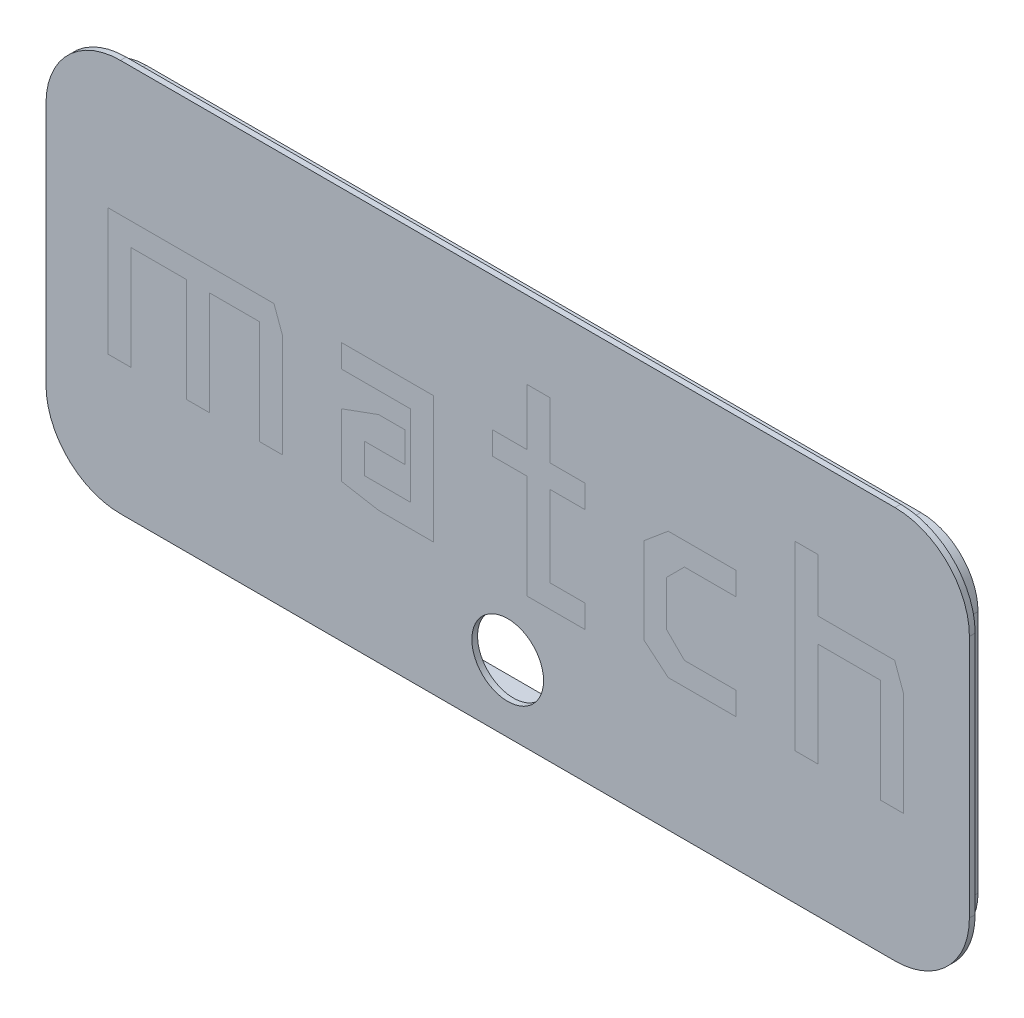
from build123d import *

# Parameters (mm, degrees)
SKIZZE1_W                         = 7.426009652
SKIZZE1_H                         = 9.839014478
AUFSATZ_LINEAR_AUSTRAGEN1_DEPTH   = 1.4
AUFSATZ_LINEAR_AUSTRAGEN1_2_DEPTH = 1.4
AUFSATZ_LINEAR_AUSTRAGEN1_3_DEPTH = 1.4
AUFSATZ_LINEAR_AUSTRAGEN1_4_DEPTH = 1.4
AUFSATZ_LINEAR_AUSTRAGEN1_5_DEPTH = 1.4
SKIZZE2_R                         = 2.5
AUFSATZ_LINEAR_AUSTRAGEN2_DEPTH   = 0.4
AUFSATZ_LINEAR_AUSTRAGEN3_DEPTH   = 1.4
SCHNITT_LINEAR_AUSTRAGEN1_DEPTH   = 36.004703161
AUFSATZ_LINEAR_AUSTRAGEN4_DEPTH   = 0.4
AUFSATZ_LINEAR_AUSTRAGEN4_2_DEPTH = 0.4
AUFSATZ_LINEAR_AUSTRAGEN4_3_DEPTH = 0.4
AUFSATZ_LINEAR_AUSTRAGEN4_4_DEPTH = 0.4
AUFSATZ_LINEAR_AUSTRAGEN4_5_DEPTH = 0.4


with BuildPart() as part:
    # Skizze1 → Aufsatz-Linear austragen1 (new body)
    with BuildSketch(Plane.XY.offset(1.6000508)):
        with Locations((-8.282016764, -0.163000133)):
            Rectangle(SKIZZE1_W, SKIZZE1_H)
        Polygon((-11.59502159, 4.356507106), (-5.169011938, 4.356507106), (-5.169011938, -4.482507372), (-8.99502159, -4.482507372), (-11.59502159, -4.024057223), (-11.59502159, 0.355123833), (-8.99502159, 1.301446442), (-7.158474477, 1.301446442), (-7.158474477, -0.799500006), (-9.99502159, -0.799500006), (-9.99502159, -2.882507372), (-6.769011938, -2.882507372), (-6.769011938, 2.756507106), (-11.59502159, 2.756507106), align=None, mode=Mode.SUBTRACT)
    extrude(amount=AUFSATZ_LINEAR_AUSTRAGEN1_DEPTH)



with BuildPart() as body_2:
    # Skizze1 → Aufsatz-Linear austragen1 2 (new body)
    with BuildSketch(Plane.XY.offset(1.6000508)):
        Polygon((-15.942281626, 4.856507106), (-28.351054102, 4.856507106), (-28.351054102, -4.982507372), (-25.751054102, -4.982507372), (-25.751054102, 2.256507106), (-22.89004318, 2.256507106), (-22.89004318, -4.982507372), (-20.29004318, -4.982507372), (-20.29004318, 2.256507106), (-17.81003302, 2.256507106), (-17.81003302, -4.982507372), (-15.21003302, -4.982507372), (-15.21003302, 2.844670596), align=None)
        Polygon((-27.851054102, -4.482507372), (-26.251054102, -4.482507372), (-26.251054102, 2.756507106), (-22.39004318, 2.756507106), (-22.39004318, -4.482507372), (-20.79004318, -4.482507372), (-20.79004318, 2.756507106), (-17.31003302, 2.756507106), (-17.31003302, -4.482507372), (-15.71003302, -4.482507372), (-15.71003302, 2.756507106), (-16.292385395, 4.356507106), (-27.851054102, 4.356507106), align=None, mode=Mode.SUBTRACT)
    extrude(amount=AUFSATZ_LINEAR_AUSTRAGEN1_2_DEPTH)


with BuildPart() as body_3:
    # Skizze1 → Aufsatz-Linear austragen1 3 (new body)
    with BuildSketch(Plane.XY.offset(1.6000508)):
        Polygon((5.872009144, 4.856507106), (3.459004318, 4.856507106), (3.459004318, 8.79351498), (0.859004318, 8.79351498), (0.859004318, 4.856507106), (-1.554000508, 4.856507106), (-1.554000508, 2.256507106), (0.859004318, 2.256507106), (0.859004318, -4.982507372), (5.872009144, -4.982507372), (5.872009144, -2.382507372), (3.459004318, -2.382507372), (3.459004318, 2.256507106), (5.872009144, 2.256507106), align=None)
        Polygon((1.359004318, 8.29351498), (1.359004318, 4.356507106), (-1.054000508, 4.356507106), (-1.054000508, 2.756507106), (1.359004318, 2.756507106), (1.359004318, -4.482507372), (5.372009144, -4.482507372), (5.372009144, -2.882507372), (2.959004318, -2.882507372), (2.959004318, 2.756507106), (5.372009144, 2.756507106), (5.372009144, 4.356507106), (2.959004318, 4.356507106), (2.959004318, 8.29351498), align=None, mode=Mode.SUBTRACT)
    extrude(amount=AUFSATZ_LINEAR_AUSTRAGEN1_3_DEPTH)


with BuildPart() as body_4:
    # Skizze1 → Aufsatz-Linear austragen1 4 (new body)
    with BuildSketch(Plane.XY.offset(1.6000508)):
        Polygon((11.009374476, 4.856507106), (16.413030226, 4.856507106), (16.413030226, 2.256507106), (12.528705026, 2.256507106), (11.587020574, 1.314822653), (11.587020574, -1.44082292), (12.528705026, -2.382507372), (16.413030226, -2.382507372), (16.413030226, -4.982507372), (11.009374476, -4.982507372), (8.987020574, -3.285550959), (8.987020574, 3.159550692), align=None)
        Polygon((15.913030226, 2.756507106), (12.321598245, 2.756507106), (11.087020574, 1.521929434), (11.087020574, -1.647929701), (12.321598245, -2.882507372), (15.913030226, -2.882507372), (15.913030226, -4.482507372), (11.191359593, -4.482507372), (9.487020574, -3.05239713), (9.487020574, 2.926396863), (11.191359593, 4.356507106), (15.913030226, 4.356507106), align=None, mode=Mode.SUBTRACT)
    extrude(amount=AUFSATZ_LINEAR_AUSTRAGEN1_4_DEPTH)


with BuildPart() as body_5:
    # Skizze1 → Aufsatz-Linear austragen1 5 (new body)
    with BuildSketch(Plane.XY.offset(1.6000508)):
        Polygon((27.258387211, 4.856507106), (22.028041656, 4.856507106), (22.028041656, 8.566514726), (19.628041656, 8.566514726), (19.628041656, -4.882507372), (22.028041656, -4.882507372), (22.028041656, 2.356507106), (25.597053594, 2.356507106), (25.597053594, -4.882507372), (27.997053594, -4.882507372), (27.997053594, 2.827037898), align=None)
        Polygon((20.028041656, 8.166514726), (20.028041656, -4.482507372), (21.628041656, -4.482507372), (21.628041656, 2.756507106), (25.997053594, 2.756507106), (25.997053594, -4.482507372), (27.597053594, -4.482507372), (27.597053594, 2.756507106), (26.978304196, 4.456507106), (21.628041656, 4.456507106), (21.628041656, 8.166514726), align=None, mode=Mode.SUBTRACT)
    extrude(amount=AUFSATZ_LINEAR_AUSTRAGEN1_5_DEPTH)


with BuildPart() as part_1:
    add(part.part)

    add(body_2.part)  # Aufsatz-Linear austragen2 merges body 2

    add(body_3.part)  # Aufsatz-Linear austragen2 merges body 3

    add(body_4.part)  # Aufsatz-Linear austragen2 merges body 4

    add(body_5.part)  # Aufsatz-Linear austragen2 merges body 5
    # Skizze2 → Aufsatz-Linear austragen2 (add)
    with BuildSketch(Plane.XY.offset(3.0000508)):
        with BuildLine():
            Line((-27.00005334, 13.687325375), (27.00005588, 13.687325375))
            ThreePointArc((27.00005588, 13.687325375), (30.668036256, 12.167998156), (32.187363475, 8.50001778))
            Line((32.187363475, 8.50001778), (32.187363475, -8.50001778))
            ThreePointArc((32.187363475, -8.50001778), (30.668036256, -12.167998156), (27.00005588, -13.687325375))
            Line((27.00005588, -13.687325375), (-27.00005334, -13.687325375))
            ThreePointArc((-27.00005334, -13.687325375), (-30.668033716, -12.167998156), (-32.187360935, -8.50001778))
            Line((-32.187360935, -8.50001778), (-32.187360935, 8.50001778))
            ThreePointArc((-32.187360935, 8.50001778), (-30.668033716, 12.167998156), (-27.00005334, 13.687325375))
        make_face()
        with Locations((0, -9.017018034)):
            Circle(SKIZZE2_R, mode=Mode.SUBTRACT)
    extrude(amount=AUFSATZ_LINEAR_AUSTRAGEN2_DEPTH)

    # Skizze3 → Aufsatz-Linear austragen3 (add)
    with BuildSketch(Plane(origin=(0, 0, 3.0000508), x_dir=(-1, 0, 0), z_dir=(0, 0, -1))):
        with BuildLine():
            Line((-30.987363475, 8.50001778), (-30.987363475, -8.50001778))
            ThreePointArc((-30.987363475, -8.50001778), (-29.819508119, -11.319470019), (-27.00005588, -12.487325375))
            Line((-27.00005588, -12.487325375), (27.00005334, -12.487325375))
            ThreePointArc((27.00005334, -12.487325375), (29.819505579, -11.319470019), (30.987360935, -8.50001778))
            Line((30.987360935, -8.50001778), (30.987360935, 8.50001778))
            ThreePointArc((30.987360935, 8.50001778), (29.819505579, 11.319470019), (27.00005334, 12.487325375))
            Line((27.00005334, 12.487325375), (-27.00005588, 12.487325375))
            ThreePointArc((-27.00005588, 12.487325375), (-29.819508119, 11.319470019), (-30.987363475, 8.50001778))
        make_face()
        with BuildLine():
            Line((27.00005334, 11.687325375), (-27.00005588, 11.687325375))
            ThreePointArc((-27.00005588, 11.687325375), (-29.253822694, 10.753784594), (-30.187363475, 8.50001778))
            Line((-30.187363475, 8.50001778), (-30.187363475, -8.50001778))
            ThreePointArc((-30.187363475, -8.50001778), (-29.253822694, -10.753784594), (-27.00005588, -11.687325375))
            Line((-27.00005588, -11.687325375), (27.00005334, -11.687325375))
            ThreePointArc((27.00005334, -11.687325375), (29.253820154, -10.753784594), (30.187360935, -8.50001778))
            Line((30.187360935, -8.50001778), (30.187360935, 8.50001778))
            ThreePointArc((30.187360935, 8.50001778), (29.253820154, 10.753784594), (27.00005334, 11.687325375))
        make_face(mode=Mode.SUBTRACT)
    extrude(amount=AUFSATZ_LINEAR_AUSTRAGEN3_DEPTH)

    # Skizze4 → Schnitt-Linear austragen1 (cut, through all)
    with BuildSketch(Plane(origin=(0, 0, 3.0000508), x_dir=(-1, 0, 0), z_dir=(0, 0, -1))):
        Polygon((26.251054102, -4.482507372), (27.851054102, -4.482507372), (27.851054102, 4.356507106), (16.292385395, 4.356507106), (15.71003302, 2.756507106), (15.71003302, -4.482507372), (17.31003302, -4.482507372), (17.31003302, 2.756507106), (20.79004318, 2.756507106), (20.79004318, -4.482507372), (22.39004318, -4.482507372), (22.39004318, 2.756507106), (26.251054102, 2.756507106), align=None)
        Polygon((7.158474477, 1.301446442), (7.158474477, -0.799500006), (9.99502159, -0.799500006), (9.99502159, -2.882507372), (6.769011938, -2.882507372), (6.769011938, 2.756507106), (11.59502159, 2.756507106), (11.59502159, 4.356507106), (5.169011938, 4.356507106), (5.169011938, -4.482507372), (8.99502159, -4.482507372), (11.59502159, -4.024057223), (11.59502159, 0.355123833), (8.99502159, 1.301446442), align=None)
        Polygon((-1.359004318, 4.356507106), (-1.359004318, 8.29351498), (-2.959004318, 8.29351498), (-2.959004318, 4.356507106), (-5.372009144, 4.356507106), (-5.372009144, 2.756507106), (-2.959004318, 2.756507106), (-2.959004318, -2.882507372), (-5.372009144, -2.882507372), (-5.372009144, -4.482507372), (-1.359004318, -4.482507372), (-1.359004318, 2.756507106), (1.054000508, 2.756507106), (1.054000508, 4.356507106), align=None)
        Polygon((-11.191359593, 4.356507106), (-15.913030226, 4.356507106), (-15.913030226, 2.756507106), (-12.321598245, 2.756507106), (-11.087020574, 1.521929434), (-11.087020574, -1.647929701), (-12.321598245, -2.882507372), (-15.913030226, -2.882507372), (-15.913030226, -4.482507372), (-11.191359593, -4.482507372), (-9.487020574, -3.05239713), (-9.487020574, 2.926396863), align=None)
        Polygon((-20.028041656, -4.482507372), (-20.028041656, 8.166514726), (-21.628041656, 8.166514726), (-21.628041656, 4.456507106), (-26.978304196, 4.456507106), (-27.597053594, 2.756507106), (-27.597053594, -4.482507372), (-25.997053594, -4.482507372), (-25.997053594, 2.756507106), (-21.628041656, 2.756507106), (-21.628041656, -4.482507372), align=None)
    extrude(amount=-SCHNITT_LINEAR_AUSTRAGEN1_DEPTH, mode=Mode.SUBTRACT)


with BuildPart() as body_2_2:
    # Skizze6 → Aufsatz-Linear austragen4 (new body)
    with BuildSketch(Plane.XY.offset(3.4000508)):
        Polygon((-26.251054102, -4.482507372), (-27.851054102, -4.482507372), (-27.851054102, 4.356507106), (-16.292385395, 4.356507106), (-15.71003302, 2.756507106), (-15.71003302, -4.482507372), (-17.31003302, -4.482507372), (-17.31003302, 2.756507106), (-20.79004318, 2.756507106), (-20.79004318, -4.482507372), (-22.39004318, -4.482507372), (-22.39004318, 2.756507106), (-26.251054102, 2.756507106), align=None)
    extrude(amount=-AUFSATZ_LINEAR_AUSTRAGEN4_DEPTH)


with BuildPart() as body_3_2:
    # Skizze6 → Aufsatz-Linear austragen4 2 (new body)
    with BuildSketch(Plane.XY.offset(3.4000508)):
        Polygon((-7.158474477, 1.301446442), (-7.158474477, -0.799500006), (-9.99502159, -0.799500006), (-9.99502159, -2.882507372), (-6.769011938, -2.882507372), (-6.769011938, 2.756507106), (-11.59502159, 2.756507106), (-11.59502159, 4.356507106), (-5.169011938, 4.356507106), (-5.169011938, -4.482507372), (-8.99502159, -4.482507372), (-11.59502159, -4.024057223), (-11.59502159, 0.355123833), (-8.99502159, 1.301446442), align=None)
    extrude(amount=-AUFSATZ_LINEAR_AUSTRAGEN4_2_DEPTH)


with BuildPart() as body_4_2:
    # Skizze6 → Aufsatz-Linear austragen4 3 (new body)
    with BuildSketch(Plane.XY.offset(3.4000508)):
        Polygon((1.359004318, 4.356507106), (1.359004318, 8.29351498), (2.959004318, 8.29351498), (2.959004318, 4.356507106), (5.372009144, 4.356507106), (5.372009144, 2.756507106), (2.959004318, 2.756507106), (2.959004318, -2.882507372), (5.372009144, -2.882507372), (5.372009144, -4.482507372), (1.359004318, -4.482507372), (1.359004318, 2.756507106), (-1.054000508, 2.756507106), (-1.054000508, 4.356507106), align=None)
    extrude(amount=-AUFSATZ_LINEAR_AUSTRAGEN4_3_DEPTH)


with BuildPart() as body_5_2:
    # Skizze6 → Aufsatz-Linear austragen4 4 (new body)
    with BuildSketch(Plane.XY.offset(3.4000508)):
        Polygon((11.191359593, 4.356507106), (15.913030226, 4.356507106), (15.913030226, 2.756507106), (12.321598245, 2.756507106), (11.087020574, 1.521929434), (11.087020574, -1.647929701), (12.321598245, -2.882507372), (15.913030226, -2.882507372), (15.913030226, -4.482507372), (11.191359593, -4.482507372), (9.487020574, -3.05239713), (9.487020574, 2.926396863), align=None)
    extrude(amount=-AUFSATZ_LINEAR_AUSTRAGEN4_4_DEPTH)


with BuildPart() as body_6:
    # Skizze6 → Aufsatz-Linear austragen4 5 (new body)
    with BuildSketch(Plane.XY.offset(3.4000508)):
        Polygon((20.028041656, -4.482507372), (20.028041656, 8.166514726), (21.628041656, 8.166514726), (21.628041656, 4.456507106), (26.978304196, 4.456507106), (27.597053594, 2.756507106), (27.597053594, -4.482507372), (25.997053594, -4.482507372), (25.997053594, 2.756507106), (21.628041656, 2.756507106), (21.628041656, -4.482507372), align=None)
    extrude(amount=-AUFSATZ_LINEAR_AUSTRAGEN4_5_DEPTH)


solid = Compound([part_1.part, body_2_2.part, body_3_2.part, body_4_2.part, body_5_2.part, body_6.part])
